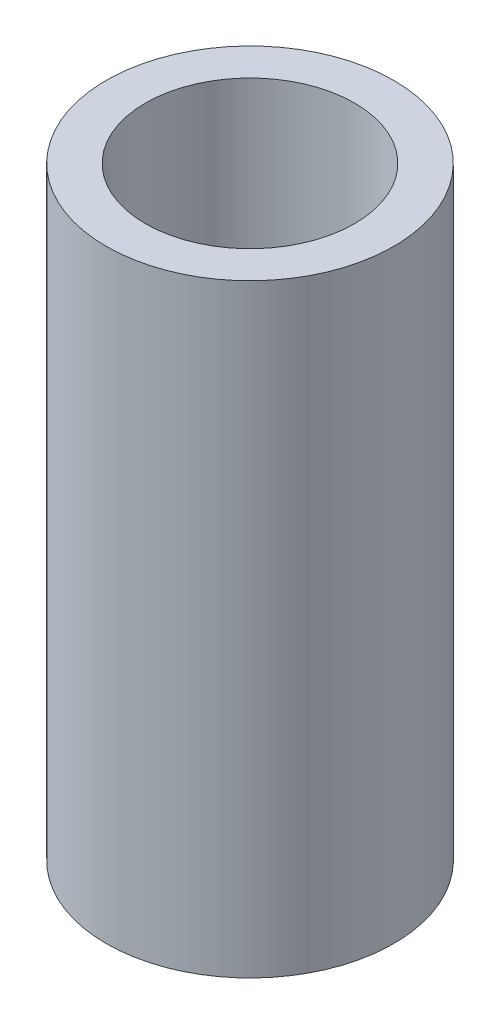
from build123d import *

# Parameters (mm, degrees)
SKETCH1_R           = 5.5
SKETCH1_R_2         = 4
BOSS_EXTRUDE1_DEPTH = 23.1


with BuildPart() as part:
    # Sketch1 → Boss-Extrude1 (new body)
    with BuildSketch(Plane(origin=(0, 0, 0), x_dir=(1, 0, 0), z_dir=(0, 1, 0))):
        with Locations(Location((0, 0, 0), (0, 0, 270))):
            Circle(SKETCH1_R)
        with Locations(Location((0, 0, 0), (0, 0, 270))):
            Circle(SKETCH1_R_2, mode=Mode.SUBTRACT)
    extrude(amount=BOSS_EXTRUDE1_DEPTH)


solid = part.part
